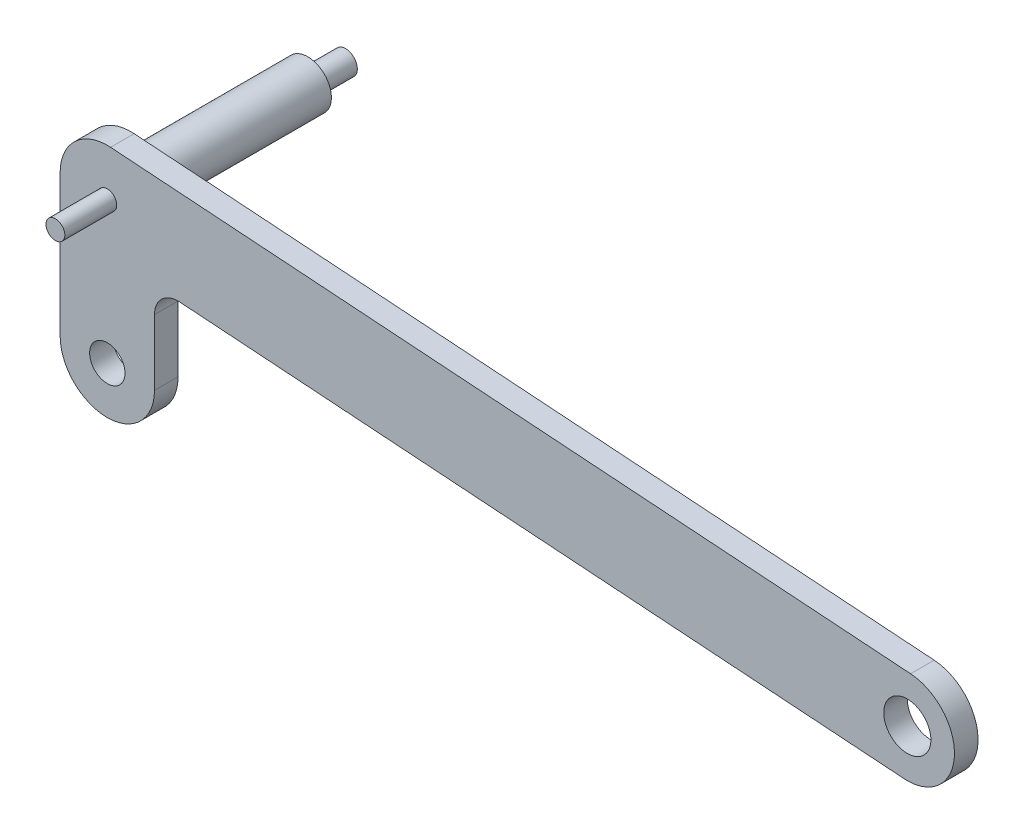
from build123d import *

# Parameters (mm, degrees)
CROQUIS1_R              = 7.5
CROQUIS1_R_2            = 10
SALIENTE_EXTRUIR1_DEPTH = 10
CROQUIS2_R              = 10
SALIENTE_EXTRUIR2_DEPTH = 75
CROQUIS3_R              = 5
SALIENTE_EXTRUIR3_DEPTH = 16
CROQUIS4_R              = 4
SALIENTE_EXTRUIR4_DEPTH = 22


with BuildPart() as part:
    # Croquis1 → Saliente-Extruir1 (new body)
    with BuildSketch(Plane.XY):
        with BuildLine():
            Line((-20, 0), (-20, 60))
            ThreePointArc((-20, 60), (-13.639967201, 74.627074032), (1.395129475, 79.951281005))
            Line((1.395129475, 79.951281005), (340.566906563, 56.234079932))
            ThreePointArc((340.566906563, 56.234079932), (359.123058094, 34.887669452), (337.776647613, 16.331517922))
            Line((337.776647613, 16.331517922), (30.697564737, 37.804579202))
            ThreePointArc((30.697564737, 37.804579202), (23.180016399, 35.142475715), (20, 27.828938699))
            Line((20, 27.828938699), (20, 0))
            ThreePointArc((20, 0), (0, -20), (-20, 0))
        make_face()
        Circle(CROQUIS1_R, mode=Mode.SUBTRACT)
        with Locations((339.171777088, 36.282798927)):
            Circle(CROQUIS1_R_2, mode=Mode.SUBTRACT)
    extrude(amount=SALIENTE_EXTRUIR1_DEPTH)

    # Croquis2 → Saliente-Extruir2 (add)
    with BuildSketch(Plane(origin=(0, 0, 0), x_dir=(-1, 0, 0), z_dir=(0, 0, -1))):
        with Locations((0, 60)):
            Circle(CROQUIS2_R)
    extrude(amount=SALIENTE_EXTRUIR2_DEPTH)

    # Croquis3 → Saliente-Extruir3 (add)
    with BuildSketch(Plane(origin=(0, 0, -75), x_dir=(-1, 0, 0), z_dir=(0, 0, -1))):
        with Locations((0, 60)):
            Circle(CROQUIS3_R)
    extrude(amount=SALIENTE_EXTRUIR3_DEPTH)

    # Croquis4 → Saliente-Extruir4 (add)
    with BuildSketch(Plane.XY.offset(10)):
        with Locations((0, 60)):
            Circle(CROQUIS4_R)
    extrude(amount=SALIENTE_EXTRUIR4_DEPTH)


solid = part.part
